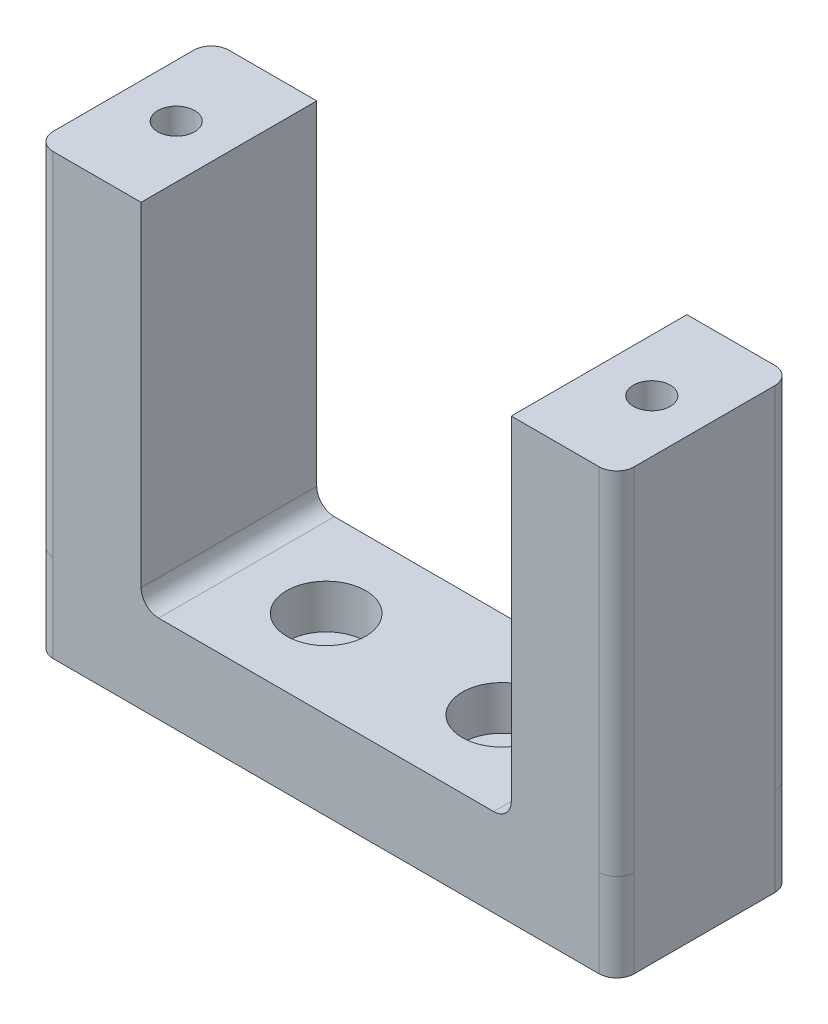
from build123d import *

# Parameters (mm, degrees)
BOSS_EXTRUDE1_DEPTH     = 10
SKETCH2_W               = 12
SKETCH2_H               = 20
BOSS_EXTRUDE2_DEPTH     = 40
SKETCH3_R               = 2.1
CUT_EXTRUDE1_DEPTH      = 86.29843199
CUT_EXTRUDE2_DEPTH      = 44
FILLET3_R               = 2
FILLET4_R               = 2
SKETCH6_R               = 2.6
CUT_EXTRUDE4_DEPTH      = 10
CUT_EXTRUDE5_DEPTH      = 5
CUT_EXTRUDE5_DEPTH_BACK = 5
SKETCH6_3_R             = 4.5
SKETCH6_3_R_2           = 2.6


with BuildPart() as part:
    # Sketch1 → Boss-Extrude1 (new body)
    with BuildSketch(Plane(origin=(0, 0, 0), x_dir=(1, 0, 0), z_dir=(0, 1, 0))):
        with BuildLine():
            Line((2, 0), (64.15, 0))
            ThreePointArc((64.15, 0), (65.564213562, 0.585786438), (66.15, 2))
            Line((66.15, 2), (66.15, 18))
            ThreePointArc((66.15, 18), (65.564213562, 19.414213562), (64.15, 20))
            Line((64.15, 20), (2, 20))
            ThreePointArc((2, 20), (0.585786438, 19.414213562), (0, 18))
            Line((0, 18), (0, 2))
            ThreePointArc((0, 2), (0.585786438, 0.585786438), (2, 0))
        make_face()
    extrude(amount=BOSS_EXTRUDE1_DEPTH)

    # Sketch2 → Boss-Extrude2 (add)
    with BuildSketch(Plane(origin=(0, 10, 0), x_dir=(1, 0, 0), z_dir=(0, 1, 0))):
        with Locations((6, 10)):
            Rectangle(SKETCH2_W, SKETCH2_H)
        with Locations((60.15, 10)):
            Rectangle(SKETCH2_W, SKETCH2_H)
    extrude(amount=BOSS_EXTRUDE2_DEPTH)

    # Sketch3 → Cut-Extrude1 (cut, through all)
    with BuildSketch(Plane(origin=(0, 50, 0), x_dir=(1, 0, 0), z_dir=(0, 1, 0))):
        with Locations(Location((6, 10, 0), (0, 0, 270))):
            Circle(SKETCH3_R)
        with Locations(Location((60.15, 10, 0), (0, 0, 270))):
            Circle(SKETCH3_R)
    extrude(amount=-CUT_EXTRUDE1_DEPTH, mode=Mode.SUBTRACT)

    # Sketch4 → Cut-Extrude2 (cut)
    with BuildSketch(Plane(origin=(0, 0, 0), x_dir=(-1, 0, 0), z_dir=(0, -1, 0))):
        Polygon((-8.121762239, 13.675), (-10.243524479, 10), (-8.121762239, 6.325), (-3.878237761, 6.325), (-1.756475521, 10), (-3.878237761, 13.675), align=None)
        Polygon((-62.271762239, 13.675), (-64.393524479, 10), (-62.271762239, 6.325), (-58.028237761, 6.325), (-55.906475521, 10), (-58.028237761, 13.675), align=None)
    extrude(amount=-CUT_EXTRUDE2_DEPTH, mode=Mode.SUBTRACT)

    # Fillet3
    fillet3_edges = [part.edges().sort_by_distance(p)[0] for p in [
        (0, 30, -20),
        (0, 30, 0),
        (66.15, 30, 0),
        (66.15, 30, -20),
    ]]
    fillet(fillet3_edges, radius=FILLET3_R)

    # Fillet4
    fillet4_edges = [part.edges().sort_by_distance(p)[0] for p in [
        (12, 10, -10),
        (54.15, 10, -10),
    ]]
    fillet(fillet4_edges, radius=FILLET4_R)

    # Sketch6 → Cut-Extrude4 (cut)
    with BuildSketch(Plane(origin=(0, 10, 0), x_dir=(1, 0, 0), z_dir=(0, 1, 0))):
        with Locations(Location((23.075, 10, 0), (0, 0, 270))):
            Circle(SKETCH6_R)
        with Locations(Location((43.075, 10, 0), (0, 0, 270))):
            Circle(SKETCH6_R)
    extrude(amount=-CUT_EXTRUDE4_DEPTH, mode=Mode.SUBTRACT)

    # Sketch6<3> → Cut-Extrude5 (cut, two sides: drawn at the far end of the back side and taken through both)
    # profile 1 of 2: a face of its own
    with BuildSketch(Plane(origin=(0, 10, 0), x_dir=(1, 0, 0), z_dir=(0, 1, 0)).offset(-CUT_EXTRUDE5_DEPTH_BACK)):
        with Locations(Location((43.075, 10, 0), (0, 0, 270))):
            Circle(SKETCH6_3_R)
        with Locations(Location((43.075, 10, 0), (0, 0, 270))):
            Circle(SKETCH6_3_R_2, mode=Mode.SUBTRACT)
    # profile 2 of 2: a face of its own
    with BuildSketch(Plane(origin=(0, 10, 0), x_dir=(1, 0, 0), z_dir=(0, 1, 0)).offset(-CUT_EXTRUDE5_DEPTH_BACK)):
        with Locations(Location((23.075, 10, 0), (0, 0, 270))):
            Circle(SKETCH6_3_R)
        with Locations(Location((23.075, 10, 0), (0, 0, 270))):
            Circle(SKETCH6_3_R_2, mode=Mode.SUBTRACT)
    extrude(amount=CUT_EXTRUDE5_DEPTH + CUT_EXTRUDE5_DEPTH_BACK, mode=Mode.SUBTRACT)


solid = part.part
